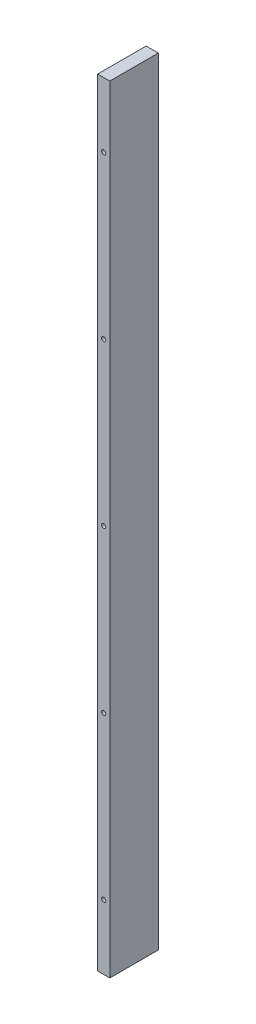
from build123d import *

# Parameters (mm, degrees)
SKETCH1_W                    = 76.2
SKETCH1_H                    = 1219.2
EXTRUDE1_DEPTH               = 19.05
F_5_16_18_TAPPED_HOLE1_D     = 6.5278
F_5_16_18_TAPPED_HOLE1_DEPTH = 22.86
F_5_16_18_TAPPED_HOLE1_TIP   = 1.961148974
F_5_16_18_TAPPED_HOLE2_D     = 6.5278
F_5_16_18_TAPPED_HOLE2_DEPTH = 22.86
F_5_16_18_TAPPED_HOLE2_TIP   = 1.961148974


with BuildPart() as part:
    # Sketch1 → Extrude1 (new body)
    with BuildSketch(Plane(origin=(0, 0, 0), x_dir=(0, 0, -1), z_dir=(1, 0, 0))):
        with Locations((38.1, 609.6)):
            Rectangle(SKETCH1_W, SKETCH1_H)
    extrude(amount=EXTRUDE1_DEPTH)

    # 5/16-18 Tapped Hole1
    with Locations(Plane.XY):
        with Locations((9.525, 1117.6), (9.525, 863.6), (9.525, 609.6), (9.525, 355.6), (9.525, 101.6)):
            Hole(F_5_16_18_TAPPED_HOLE1_D / 2, depth=F_5_16_18_TAPPED_HOLE1_DEPTH)
            with Locations((0, 0, -(F_5_16_18_TAPPED_HOLE1_DEPTH + F_5_16_18_TAPPED_HOLE1_TIP / 2))):  # 118° drill point
                Cone(0, F_5_16_18_TAPPED_HOLE1_D / 2, F_5_16_18_TAPPED_HOLE1_TIP, mode=Mode.SUBTRACT)

    # 5/16-18 Tapped Hole2
    with Locations(Plane.XZ):
        with Locations((9.525, -63.5), (9.525, -12.7)):
            Hole(F_5_16_18_TAPPED_HOLE2_D / 2, depth=F_5_16_18_TAPPED_HOLE2_DEPTH)
            with Locations((0, 0, -(F_5_16_18_TAPPED_HOLE2_DEPTH + F_5_16_18_TAPPED_HOLE2_TIP / 2))):  # 118° drill point
                Cone(0, F_5_16_18_TAPPED_HOLE2_D / 2, F_5_16_18_TAPPED_HOLE2_TIP, mode=Mode.SUBTRACT)


solid = part.part
